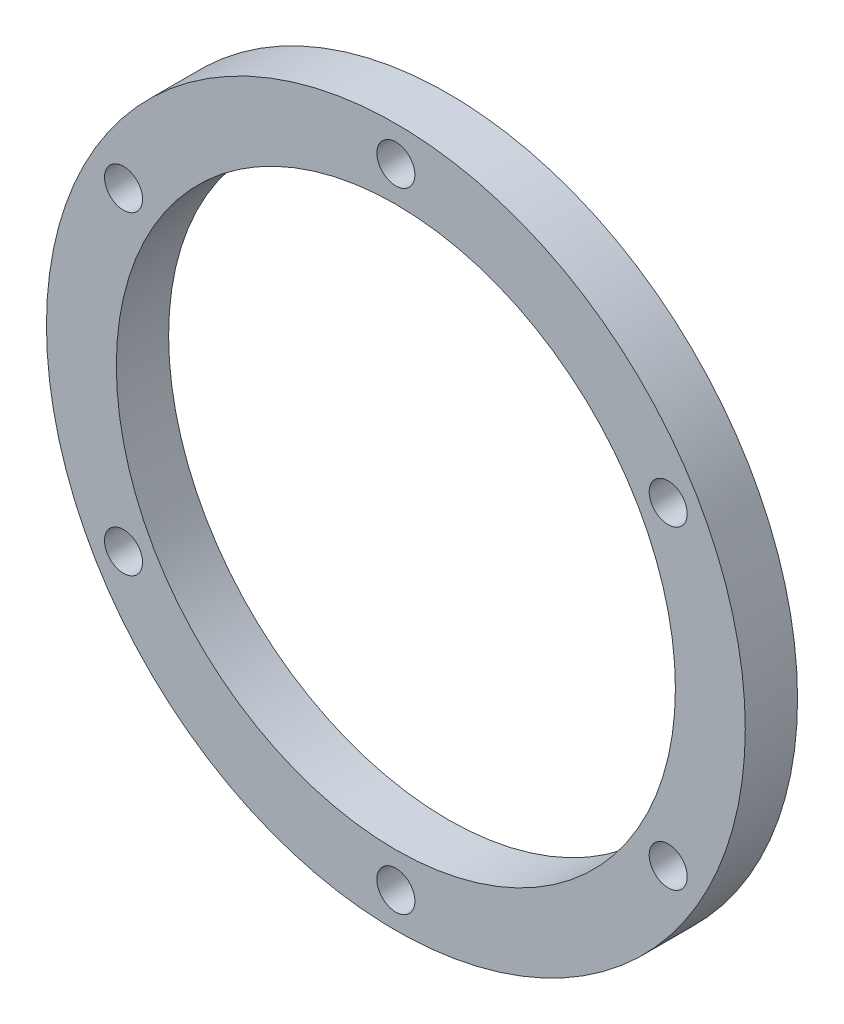
from build123d import *

# Parameters (mm, degrees)
SKETCH1_R             = 31.75
SKETCH1_R_2           = 25.4
BOSS_EXTRUDE1_DEPTH   = 4.7498
F_8_32_TAPPED_HOLE1_D = 3.4544


with BuildPart() as part:
    # Sketch1 → Boss-Extrude1 (new body)
    with BuildSketch(Plane.XY):
        Circle(SKETCH1_R)
        Circle(SKETCH1_R_2, mode=Mode.SUBTRACT)
    extrude(amount=BOSS_EXTRUDE1_DEPTH)

    # #8-32 Tapped Hole1 (through all)
    with Locations(Plane.XY.offset(4.7498)):
        with Locations((0, 28.575), (24.746675913, 14.2875), (24.746675913, -14.2875), (0, -28.575), (-24.746675913, -14.2875), (-24.746675913, 14.2875)):
            Hole(F_8_32_TAPPED_HOLE1_D / 2)


solid = part.part
